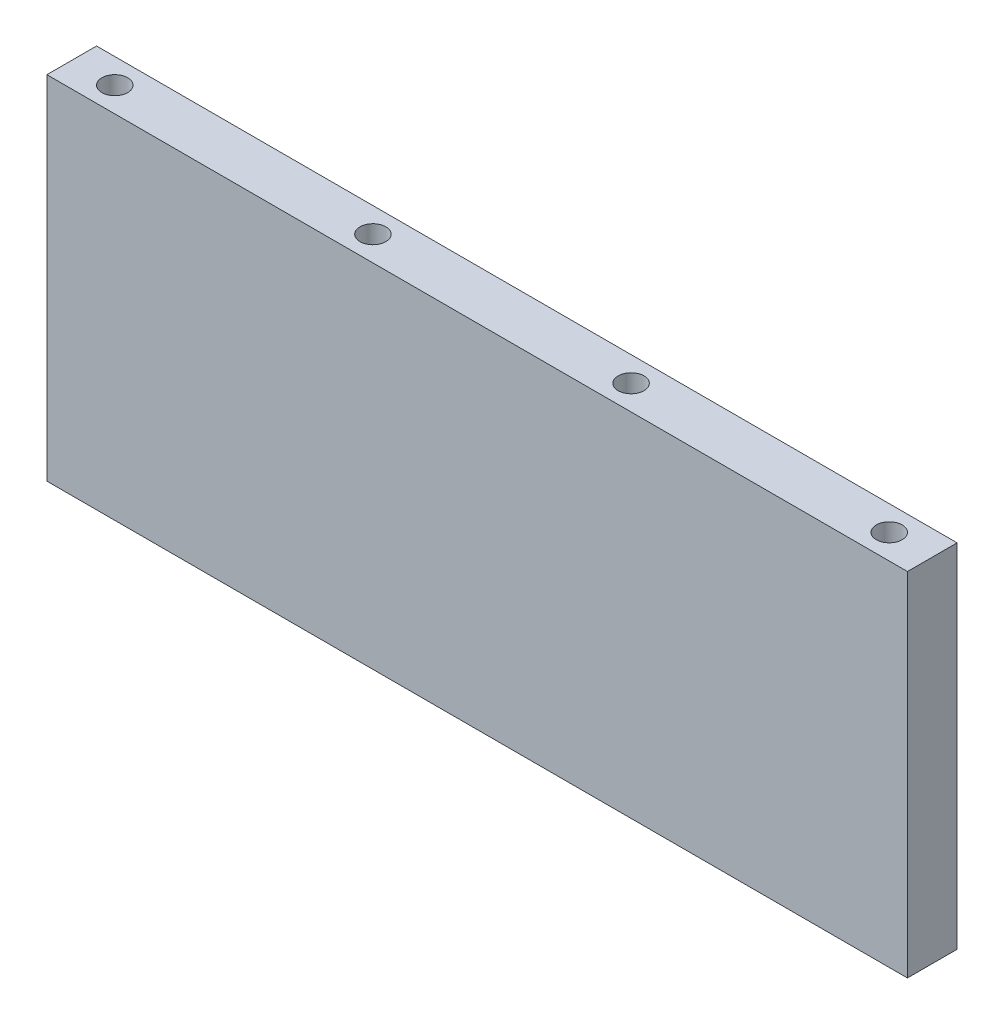
from build123d import *

# Parameters (mm, degrees)
SKETCH1_W             = 110
SKETCH1_H             = 45
BOSS_EXTRUDE1_DEPTH   = 6.35
M4X0_7_TAPPED_HOLE1_D = 3.3


with BuildPart() as part:
    # Sketch1 → Boss-Extrude1 (new body)
    with BuildSketch(Plane.XY):
        with Locations((55, 22.5)):
            Rectangle(SKETCH1_W, SKETCH1_H)
    extrude(amount=BOSS_EXTRUDE1_DEPTH)

    # M4x0.7 Tapped Hole1 (through all)
    with Locations(Plane(origin=(0, 45, 0), x_dir=(1, 0, 0), z_dir=(0, 1, 0))):
        with Locations((5.5, -3.175), (38.5, -3.175), (71.5, -3.175), (104.5, -3.175)):
            Hole(M4X0_7_TAPPED_HOLE1_D / 2)


solid = part.part
